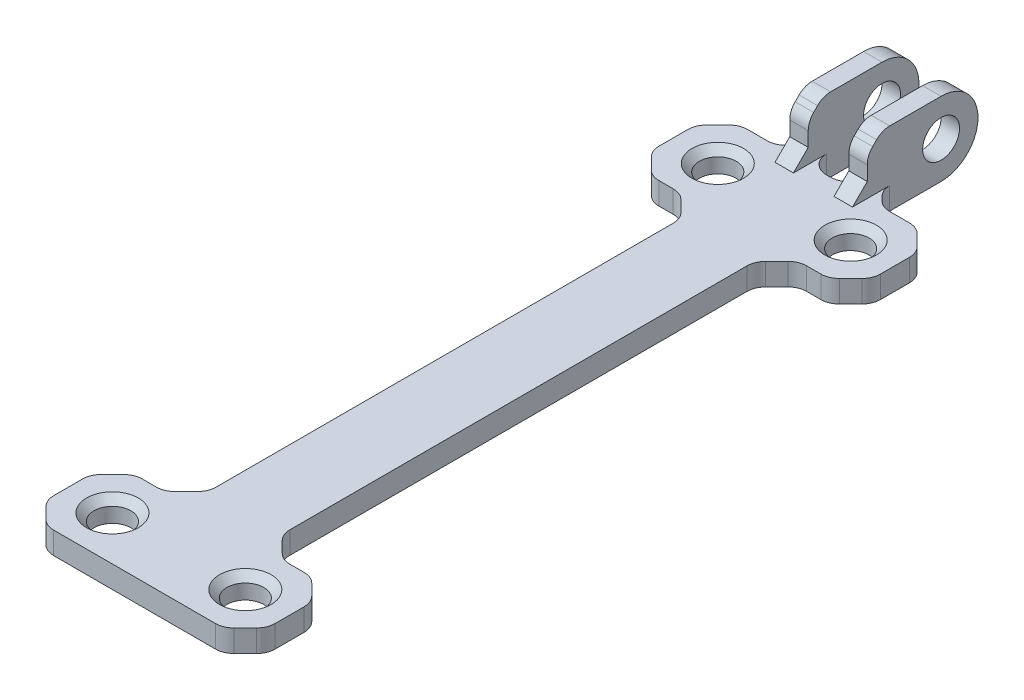
from build123d import *

# Parameters (mm, degrees)
SKETCH2_R                   = 2.5
BOSS_EXTRUDE1_DEPTH         = 3
BOSS_EXTRUDE2_START         = 2.75
SKETCH3_W                   = 15
SKETCH3_H                   = 10
BOSS_EXTRUDE2_DEPTH         = 2.5
FILLET2_RADIUS              = 5
FILLET2_LENGTH              = 2.5
FILLET2_OF_MIRROR1_2_RADIUS = 5
FILLET2_OF_MIRROR1_2_LENGTH = 2.5
CHAMFER1_SIZE               = 2
CHAMFER2_SIZE               = 2
SKETCH5_R                   = 2.5
CUT_EXTRUDE2_DEPTH          = 97.675035557
CHAMFER3_SIZE               = 3
FILLET3_R                   = 2.5
CHAMFER4_SIZE               = 1


with BuildPart() as part:
    # Sketch2 → Boss-Extrude1 (new body)
    with BuildSketch(Plane(origin=(0, 0, 0), x_dir=(1, 0, 0), z_dir=(0, 1, 0))):
        Polygon((15, 0), (-15, 0), (-15, -12), (-5, -12), (-5, -82), (-15, -82), (-15, -94), (15, -94), (15, -82), (5, -82), (5, -12), (15, -12), align=None)
        with Locations(Location((-9, -6, 0), (0, 0, 270))):
            Circle(SKETCH2_R, mode=Mode.SUBTRACT)
        with Locations(Location((-9, -88, 0), (0, 0, 270))):
            Circle(SKETCH2_R, mode=Mode.SUBTRACT)
        with Locations(Location((9, -88, 0), (0, 0, 270))):
            Circle(SKETCH2_R, mode=Mode.SUBTRACT)
        with Locations(Location((9, -6, 0), (0, 0, 270))):
            Circle(SKETCH2_R, mode=Mode.SUBTRACT)
    extrude(amount=BOSS_EXTRUDE1_DEPTH)

    # Sketch3 → Boss-Extrude2 (add)
    with BuildSketch(Plane(origin=(0, 0, 0), x_dir=(0, 0, -1), z_dir=(1, 0, 0)).offset(BOSS_EXTRUDE2_START)):
        with Locations((7.5, 5)):
            Rectangle(SKETCH3_W, SKETCH3_H)
    boss_extrude2 = extrude(amount=BOSS_EXTRUDE2_DEPTH)

    # Fillet2: full round fillet: the end face becomes a half cylinder, R = half its width
    fillet2_face = Plane((4, 5, -15), x_dir=(-1, 0, 0), z_dir=(0, 0, -1))  # on the end face: x along it, z out of the body
    fillet2_slab = fillet2_face.offset(-FILLET2_RADIUS / 2) * Box(FILLET2_LENGTH, 2 * FILLET2_RADIUS, FILLET2_RADIUS, mode=Mode.PRIVATE)  # the body's end, R deep
    fillet2_round = Plane((4, 5, -10), x_dir=(0, 0, -1), z_dir=(-1, 0, 0)) * Cylinder(FILLET2_RADIUS, FILLET2_LENGTH, mode=Mode.PRIVATE)  # its axis R under the face
    add(fillet2_slab - fillet2_round, mode=Mode.SUBTRACT)

    # Mirror1: Boss-Extrude2 across plane
    add(boss_extrude2.mirror(Plane(origin=(0, 0, 0), x_dir=(0, 0, 1), z_dir=(1, 0, 0))))

    # Fillet2 of Mirror1 2: full round fillet: the end face becomes a half cylinder, R = half its width
    fillet2_of_mirror1_2_face = Plane((-4, 5, -15), x_dir=(1, 0, 0), z_dir=(0, 0, -1))  # on the end face: x along it, z out of the body
    fillet2_of_mirror1_2_slab = fillet2_of_mirror1_2_face.offset(-FILLET2_OF_MIRROR1_2_RADIUS / 2) * Box(FILLET2_OF_MIRROR1_2_LENGTH, 2 * FILLET2_OF_MIRROR1_2_RADIUS, FILLET2_OF_MIRROR1_2_RADIUS, mode=Mode.PRIVATE)  # the body's end, R deep
    fillet2_of_mirror1_2_round = Plane((-4, 5, -10), x_dir=(0, 0, -1), z_dir=(1, 0, 0)) * Cylinder(FILLET2_OF_MIRROR1_2_RADIUS, FILLET2_OF_MIRROR1_2_LENGTH, mode=Mode.PRIVATE)  # its axis R under the face
    add(fillet2_of_mirror1_2_slab - fillet2_of_mirror1_2_round, mode=Mode.SUBTRACT)

    # Chamfer1
    chamfer1_edges = [part.edges().sort_by_distance(p)[0] for p in [
        (4, 3, 0),
        (-4, 3, 0),
    ]]
    chamfer(chamfer1_edges, length=CHAMFER1_SIZE)

    # Chamfer2
    chamfer2_edges = [part.edges().sort_by_distance(p)[0] for p in [
        (-5.25, 1.5, 0),
        (5.25, 1.5, 0),
        (4, 10, 0),
        (-4, 10, 0),
    ]]
    chamfer(chamfer2_edges, length=CHAMFER2_SIZE)

    # Sketch5 → Cut-Extrude2 (cut, through all)
    with BuildSketch(Plane(origin=(5.25, 0, 0), x_dir=(0, 0, -1), z_dir=(1, 0, 0))):
        with Locations((10, 5)):
            Circle(SKETCH5_R)
    extrude(amount=-CUT_EXTRUDE2_DEPTH, mode=Mode.SUBTRACT)

    # Chamfer3
    chamfer3_edges = [part.edges().sort_by_distance(p)[0] for p in [
        (15, 1.5, 12),
        (5, 1.5, 12),
        (5, 1.5, 82),
        (15, 1.5, 82),
        (15, 1.5, 94),
        (-15, 1.5, 94),
        (-15, 1.5, 82),
        (-5, 1.5, 82),
        (-5, 1.5, 12),
        (-15, 1.5, 12),
        (-15, 1.5, 0),
        (15, 1.5, 0),
    ]]
    chamfer(chamfer3_edges, length=CHAMFER3_SIZE)

    # Fillet3
    fillet3_edges = [part.edges().sort_by_distance(p)[0] for p in [
        (-15, 1.5, 85),
        (-12, 1.5, 82),
        (-8, 1.5, 82),
        (-5, 1.5, 79),
        (-5, 1.5, 15),
        (-8, 1.5, 12),
        (-12, 1.5, 12),
        (-15, 1.5, 9),
        (-12, 1.5, 0),
        (-7.25, 1.5, 0),
        (-5.25, 1.5, -2),
        (-2.75, 1.5, 0),
        (2.75, 1.5, 0),
        (5.25, 1.5, -2),
        (7.25, 1.5, 0),
        (12, 1.5, 0),
        (15, 1.5, 3),
        (15, 1.5, 9),
        (12, 1.5, 12),
        (8, 1.5, 12),
        (5, 1.5, 15),
        (5, 1.5, 79),
        (8, 1.5, 82),
        (12, 1.5, 82),
        (15, 1.5, 85),
        (15, 1.5, 91),
        (12, 1.5, 94),
        (-12, 1.5, 94),
        (-15, 1.5, 91),
        (-15, 1.5, 3),
        (4, 8, 0),
        (4, 10, -2),
        (-4, 10, -2),
        (-4, 8, 0),
    ]]
    fillet(fillet3_edges, radius=FILLET3_R)

    # Chamfer4
    chamfer4_edges = [part.edges().sort_by_distance(p)[0] for p in [
        (9, 3, 85.5),
        (-9, 3, 85.5),
        (-9, 3, 3.5),
        (9, 3, 3.5),
    ]]
    chamfer(chamfer4_edges, length=CHAMFER4_SIZE)


solid = part.part
